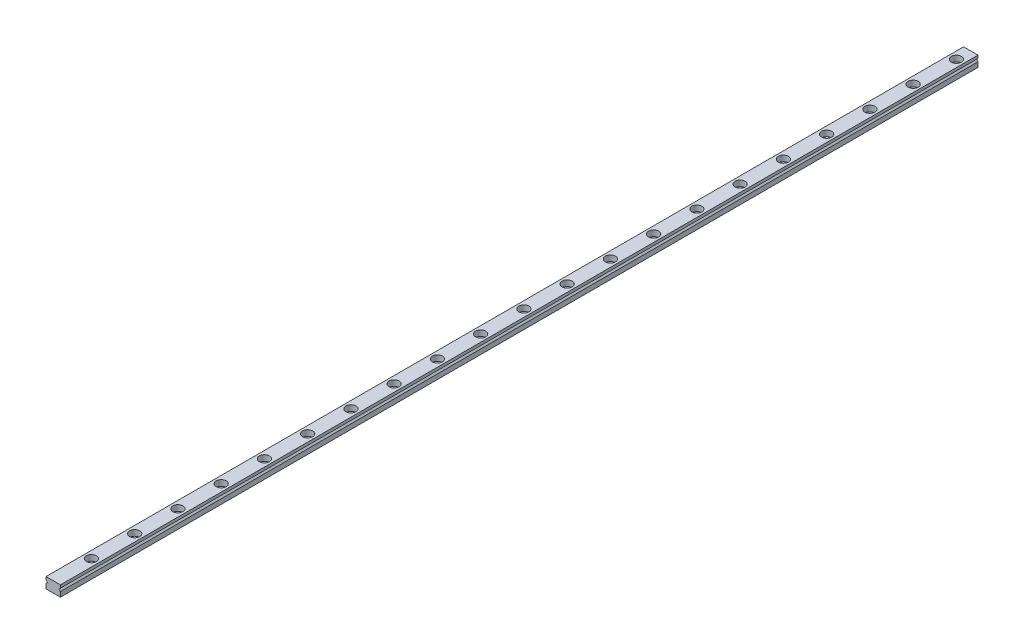
from build123d import *

# Parameters (mm, degrees)
SKETCH1_W           = 5
SKETCH1_H           = 3.7
BOSS_EXTRUDE1_DEPTH = 400
SKETCH2_R           = 1.75
CUT_EXTRUDE1_DEPTH  = 2
SKETCH3_R           = 1
CUT_EXTRUDE2_DEPTH  = 401.036248358
CUT_EXTRUDE3_DEPTH  = 401.048359577
CUT_EXTRUDE_1_DEPTH = 10


with BuildPart() as part:
    # Sketch1 → Boss-Extrude1 (new body)
    with BuildSketch(Plane.XY):
        with Locations((2.5, 1.85)):
            Rectangle(SKETCH1_W, SKETCH1_H)
    extrude(amount=-BOSS_EXTRUDE1_DEPTH)

    # Sketch2 → Cut-Extrude1 (cut)
    with BuildSketch(Plane(origin=(0, 3.7, 0), x_dir=(1, 0, 0), z_dir=(0, 1, 0))):
        with Locations(Location((2.5, 5, 0), (0, 0, 270))):
            Circle(SKETCH2_R)
        with Locations(Location((2.5, 20, 0), (0, 0, 270))):
            Circle(SKETCH2_R)
        with Locations(Location((2.5, 35, 0), (0, 0, 270))):
            Circle(SKETCH2_R)
        with Locations(Location((2.5, 50, 0), (0, 0, 270))):
            Circle(SKETCH2_R)
        with Locations(Location((2.5, 65, 0), (0, 0, 270))):
            Circle(SKETCH2_R)
        with Locations(Location((2.5, 80, 0), (0, 0, 270))):
            Circle(SKETCH2_R)
        with Locations(Location((2.5, 95, 0), (0, 0, 270))):
            Circle(SKETCH2_R)
        with Locations(Location((2.5, 110, 0), (0, 0, 270))):
            Circle(SKETCH2_R)
        with Locations(Location((2.5, 125, 0), (0, 0, 270))):
            Circle(SKETCH2_R)
        with Locations(Location((2.5, 140, 0), (0, 0, 270))):
            Circle(SKETCH2_R)
        with Locations(Location((2.5, 155, 0), (0, 0, 270))):
            Circle(SKETCH2_R)
        with Locations(Location((2.5, 170, 0), (0, 0, 270))):
            Circle(SKETCH2_R)
        with Locations(Location((2.5, 185, 0), (0, 0, 270))):
            Circle(SKETCH2_R)
        with Locations(Location((2.5, 200, 0), (0, 0, 270))):
            Circle(SKETCH2_R)
        with Locations(Location((2.5, 215, 0), (0, 0, 270))):
            Circle(SKETCH2_R)
        with Locations(Location((2.5, 230, 0), (0, 0, 270))):
            Circle(SKETCH2_R)
        with Locations(Location((2.5, 245, 0), (0, 0, 270))):
            Circle(SKETCH2_R)
        with Locations(Location((2.5, 260, 0), (0, 0, 270))):
            Circle(SKETCH2_R)
        with Locations(Location((2.5, 275, 0), (0, 0, 270))):
            Circle(SKETCH2_R)
        with Locations(Location((2.5, 290, 0), (0, 0, 270))):
            Circle(SKETCH2_R)
        with Locations(Location((2.5, 305, 0), (0, 0, 270))):
            Circle(SKETCH2_R)
        with Locations(Location((2.5, 320, 0), (0, 0, 270))):
            Circle(SKETCH2_R)
        with Locations(Location((2.5, 335, 0), (0, 0, 270))):
            Circle(SKETCH2_R)
        with Locations(Location((2.5, 350, 0), (0, 0, 270))):
            Circle(SKETCH2_R)
        with Locations(Location((2.5, 365, 0), (0, 0, 270))):
            Circle(SKETCH2_R)
        with Locations(Location((2.5, 380, 0), (0, 0, 270))):
            Circle(SKETCH2_R)
        with Locations(Location((2.5, 395, 0), (0, 0, 270))):
            Circle(SKETCH2_R)
    extrude(amount=-CUT_EXTRUDE1_DEPTH, mode=Mode.SUBTRACT)

    # Sketch3 → Cut-Extrude2 (cut, through all)
    with BuildSketch(Plane(origin=(0, 1.7, 0), x_dir=(1, 0, 0), z_dir=(0, 1, 0))):
        with Locations(Location((2.5, 5, 0), (0, 0, 270))):
            Circle(SKETCH3_R)
        with Locations(Location((2.5, 20, 0), (0, 0, 270))):
            Circle(SKETCH3_R)
        with Locations(Location((2.5, 35, 0), (0, 0, 270))):
            Circle(SKETCH3_R)
        with Locations(Location((2.5, 50, 0), (0, 0, 270))):
            Circle(SKETCH3_R)
        with Locations(Location((2.5, 65, 0), (0, 0, 270))):
            Circle(SKETCH3_R)
        with Locations(Location((2.5, 80, 0), (0, 0, 270))):
            Circle(SKETCH3_R)
        with Locations(Location((2.5, 95, 0), (0, 0, 270))):
            Circle(SKETCH3_R)
        with Locations(Location((2.5, 110, 0), (0, 0, 270))):
            Circle(SKETCH3_R)
        with Locations(Location((2.5, 125, 0), (0, 0, 270))):
            Circle(SKETCH3_R)
        with Locations(Location((2.5, 140, 0), (0, 0, 270))):
            Circle(SKETCH3_R)
        with Locations(Location((2.5, 155, 0), (0, 0, 270))):
            Circle(SKETCH3_R)
        with Locations(Location((2.5, 170, 0), (0, 0, 270))):
            Circle(SKETCH3_R)
        with Locations(Location((2.5, 185, 0), (0, 0, 270))):
            Circle(SKETCH3_R)
        with Locations(Location((2.5, 200, 0), (0, 0, 270))):
            Circle(SKETCH3_R)
        with Locations(Location((2.5, 215, 0), (0, 0, 270))):
            Circle(SKETCH3_R)
        with Locations(Location((2.5, 230, 0), (0, 0, 270))):
            Circle(SKETCH3_R)
        with Locations(Location((2.5, 245, 0), (0, 0, 270))):
            Circle(SKETCH3_R)
        with Locations(Location((2.5, 260, 0), (0, 0, 270))):
            Circle(SKETCH3_R)
        with Locations(Location((2.5, 275, 0), (0, 0, 270))):
            Circle(SKETCH3_R)
        with Locations(Location((2.5, 290, 0), (0, 0, 270))):
            Circle(SKETCH3_R)
        with Locations(Location((2.5, 305, 0), (0, 0, 270))):
            Circle(SKETCH3_R)
        with Locations(Location((2.5, 320, 0), (0, 0, 270))):
            Circle(SKETCH3_R)
        with Locations(Location((2.5, 335, 0), (0, 0, 270))):
            Circle(SKETCH3_R)
        with Locations(Location((2.5, 350, 0), (0, 0, 270))):
            Circle(SKETCH3_R)
        with Locations(Location((2.5, 365, 0), (0, 0, 270))):
            Circle(SKETCH3_R)
        with Locations(Location((2.5, 380, 0), (0, 0, 270))):
            Circle(SKETCH3_R)
        with Locations(Location((2.5, 395, 0), (0, 0, 270))):
            Circle(SKETCH3_R)
    extrude(amount=-CUT_EXTRUDE2_DEPTH, mode=Mode.SUBTRACT)

    # Sketch4 → Cut-Extrude3 (cut, through all)
    with BuildSketch(Plane.XY):
        Polygon((0, 2.7), (0.5, 2.2), (0, 1.7), align=None)
        Polygon((5, 2.7), (4.5, 2.2), (5, 1.7), align=None)
    extrude(amount=-CUT_EXTRUDE3_DEPTH, mode=Mode.SUBTRACT)

    # 草图1 → 切除-拉伸1 (cut)
    with BuildSketch(Plane(origin=(0, 3.7, 0), x_dir=(1, 0, 0), z_dir=(0, 1, 0))):
        Polygon((2.5, 81.75), (15.113647071, 81.75), (15.113647071, -29.694752228), (-58.541015393, -29.694752228), (-58.541015393, 81.75), align=None)
    extrude(amount=-CUT_EXTRUDE_1_DEPTH, mode=Mode.SUBTRACT)


solid = part.part
